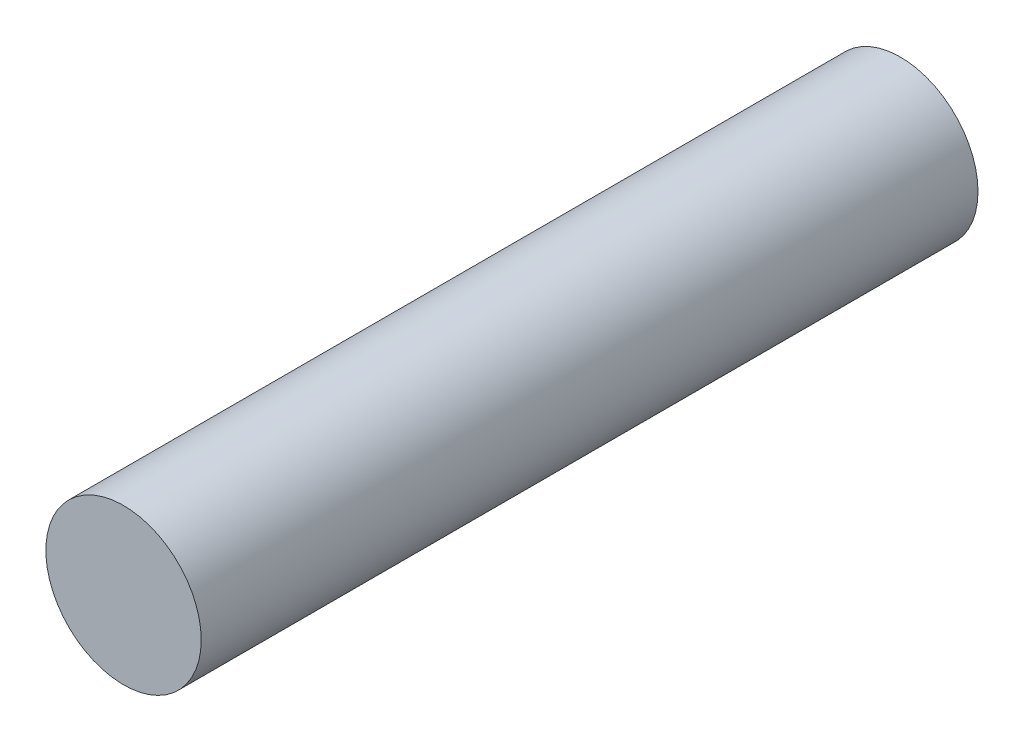
from build123d import *

# Parameters (mm, degrees)
SKETCH1_R           = 5
BOSS_EXTRUDE1_DEPTH = 50


with BuildPart() as part:
    # Sketch1 → Boss-Extrude1 (new body)
    with BuildSketch(Plane.XY):
        Circle(SKETCH1_R)
    extrude(amount=BOSS_EXTRUDE1_DEPTH)


solid = part.part
